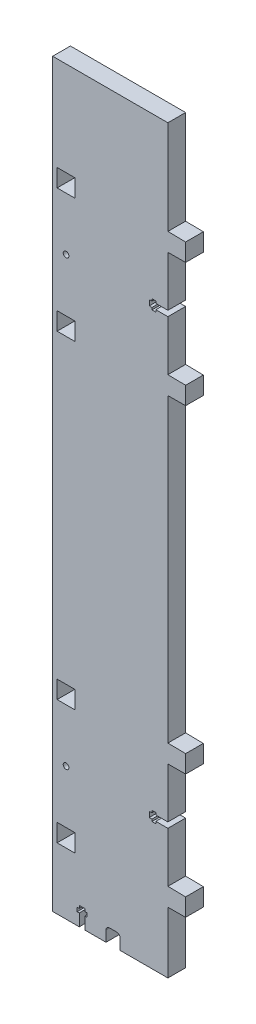
from build123d import *

# Parameters (mm, degrees)
SKETCH_1_R      = 1.6
SKETCH_1_W      = 10.1
SKETCH_1_H      = 10
EXTRUDE_1_DEPTH = 10


with BuildPart() as part:
    # Эскиз1 → Бобышка-Вытянуть1 (new body)
    with BuildSketch(Plane.XY):
        with BuildLine():
            Line((-37.4993057, -208.951162), (-37.4993057, 208.951162))
            Line((-37.4993057, 208.951162), (27.5006943, 208.951162))
            Line((27.5006943, 208.951162), (27.5006943, 155.851162))
            Line((27.5006943, 155.851162), (37.4993057, 155.684518477))
            Line((37.4993057, 155.684518477), (37.4993057, 145.684518477))
            Line((37.4993057, 145.684518477), (27.5006943, 145.651162))
            Line((27.5006943, 145.651162), (27.5006943, 117.301162))
            Line((27.5006943, 117.301162), (20.7006943, 117.301162))
            Line((20.7006943, 117.301162), (20.7006943, 118.501162))
            Line((20.7006943, 118.501162), (18.5006943, 118.501162))
            Line((18.5006943, 118.501162), (18.5006943, 117.301162))
            Line((18.5006943, 117.301162), (17.0006943, 117.301162))
            Line((17.0006943, 117.301162), (17.0006943, 114.201162))
            Line((17.0006943, 114.201162), (18.5006943, 114.201162))
            Line((18.5006943, 114.201162), (18.5006943, 113.001162))
            Line((18.5006943, 113.001162), (20.7006943, 113.001162))
            Line((20.7006943, 113.001162), (20.7006943, 114.201162))
            Line((20.7006943, 114.201162), (27.5006943, 114.201162))
            Line((27.5006943, 114.201162), (27.5006943, 85.851162))
            Line((27.5006943, 85.851162), (37.4993057, 85.684518477))
            Line((37.4993057, 85.684518477), (37.4993057, 75.684518477))
            Line((37.4993057, 75.684518477), (27.5006943, 75.651162))
            Line((27.5006943, 75.651162), (27.5006943, -94.148838))
            Line((27.5006943, -94.148838), (37.4993057, -94.315481523))
            Line((37.4993057, -94.315481523), (37.4993057, -104.315481523))
            Line((37.4993057, -104.315481523), (27.5006943, -104.348838))
            Line((27.5006943, -104.348838), (27.5006943, -132.698838))
            Line((27.5006943, -132.698838), (20.7006943, -132.698838))
            Line((20.7006943, -132.698838), (20.7006943, -131.498838))
            Line((20.7006943, -131.498838), (18.5006943, -131.498838))
            Line((18.5006943, -131.498838), (18.5006943, -132.698838))
            Line((18.5006943, -132.698838), (17.0006943, -132.698838))
            Line((17.0006943, -132.698838), (17.0006943, -135.798838))
            Line((17.0006943, -135.798838), (18.5006943, -135.798838))
            Line((18.5006943, -135.798838), (18.5006943, -136.998838))
            Line((18.5006943, -136.998838), (20.7006943, -136.998838))
            Line((20.7006943, -136.998838), (20.7006943, -135.798838))
            Line((20.7006943, -135.798838), (27.5006943, -135.798838))
            Line((27.5006943, -135.798838), (27.5006943, -164.148838))
            Line((27.5006943, -164.148838), (37.4993057, -164.315481523))
            Line((37.4993057, -164.315481523), (37.4993057, -174.315481523))
            Line((37.4993057, -174.315481523), (27.5006943, -174.348838))
            Line((27.5006943, -174.348838), (27.5006943, -208.951162))
            Line((27.5006943, -208.951162), (0.6006943, -208.951162))
            Line((0.6006943, -208.951162), (0.6006943, -202.951162))
            ThreePointArc((0.6006943, -202.951162), (0.014907862, -201.536948438), (-1.3993057, -200.951162))
            Line((-1.3993057, -200.951162), (-5.3993057, -200.951162))
            ThreePointArc((-5.3993057, -200.951162), (-6.813519263, -201.536948438), (-7.3993057, -202.951162))
            Line((-7.3993057, -202.951162), (-7.3993057, -208.951162))
            Line((-7.3993057, -208.951162), (-19.3993057, -208.951162))
            Line((-19.3993057, -208.951162), (-19.3993057, -202.151162))
            Line((-19.3993057, -202.151162), (-18.1993057, -202.151162))
            Line((-18.1993057, -202.151162), (-18.1993057, -199.951162))
            Line((-18.1993057, -199.951162), (-19.3993057, -199.951162))
            Line((-19.3993057, -199.951162), (-19.3993057, -198.451162))
            Line((-19.3993057, -198.451162), (-22.4993057, -198.451162))
            Line((-22.4993057, -198.451162), (-22.4993057, -199.951162))
            Line((-22.4993057, -199.951162), (-23.6993057, -199.951162))
            Line((-23.6993057, -199.951162), (-23.6993057, -202.151162))
            Line((-23.6993057, -202.151162), (-22.4993057, -202.151162))
            Line((-22.4993057, -202.151162), (-22.4993057, -208.951162))
            Line((-22.4993057, -208.951162), (-37.4993057, -208.951162))
        make_face()
        with Locations((-29.9493057, 115.851162)):
            Circle(SKETCH_1_R, mode=Mode.SUBTRACT)
        with Locations((-29.9493057, -134.148838)):
            Circle(SKETCH_1_R, mode=Mode.SUBTRACT)
        with Locations((-29.9493057, 150.851162)):
            Rectangle(SKETCH_1_W, SKETCH_1_H, mode=Mode.SUBTRACT)
        with Locations((-29.9493057, -169.148838)):
            Rectangle(SKETCH_1_W, SKETCH_1_H, mode=Mode.SUBTRACT)
        with Locations((-29.9493057, 80.851162)):
            Rectangle(SKETCH_1_W, SKETCH_1_H, mode=Mode.SUBTRACT)
        with Locations((-29.9493057, -99.148838)):
            Rectangle(SKETCH_1_W, SKETCH_1_H, mode=Mode.SUBTRACT)
    extrude(amount=EXTRUDE_1_DEPTH)


solid = part.part
